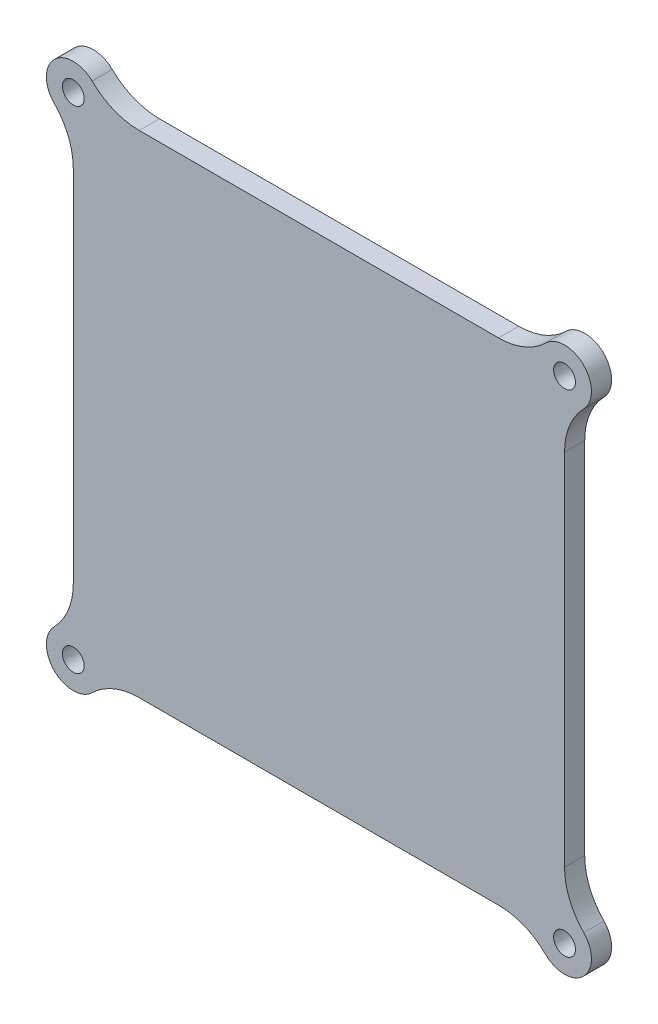
from build123d import *

# Parameters (mm, degrees)
SKETCH_1_R      = 1.625
EXTRUDE_1_DEPTH = 3
FILLET_1_R      = 10


with BuildPart() as part:
    # Эскиз1 → Бобышка-Вытянуть1 (new body)
    with BuildSketch(Plane.XY):
        with BuildLine():
            ThreePointArc((-36.516055554, -32.516055554), (-39.344482678, -39.344482678), (-32.516055554, -36.516055554))
            Line((-32.516055554, -36.516055554), (32.516055554, -36.516055554))
            ThreePointArc((32.516055554, -36.516055554), (39.344482678, -39.344482678), (36.516055554, -32.516055554))
            Line((36.516055554, -32.516055554), (36.516055554, 32.516055554))
            ThreePointArc((36.516055554, 32.516055554), (39.344482678, 39.344482678), (32.516055554, 36.516055554))
            Line((32.516055554, 36.516055554), (-32.516055554, 36.516055554))
            ThreePointArc((-32.516055554, 36.516055554), (-39.344482678, 39.344482678), (-36.516055554, 32.516055554))
            Line((-36.516055554, 32.516055554), (-36.516055554, -32.516055554))
        make_face()
        with Locations((-36.516055554, -36.516055554)):
            Circle(SKETCH_1_R, mode=Mode.SUBTRACT)
        with Locations((36.516055554, 36.516055554)):
            Circle(SKETCH_1_R, mode=Mode.SUBTRACT)
        with Locations((-36.516055554, 36.516055554)):
            Circle(SKETCH_1_R, mode=Mode.SUBTRACT)
        with Locations((36.516055554, -36.516055554)):
            Circle(SKETCH_1_R, mode=Mode.SUBTRACT)
    extrude(amount=EXTRUDE_1_DEPTH)

    # Скругление1
    fillet_1_edges = [part.edges().sort_by_distance(p)[0] for p in [
        (-36.516055554, -32.516055554, 1.5),
        (-36.516055554, 32.516055554, 1.5),
        (-32.516055554, 36.516055554, 1.5),
        (32.516055554, 36.516055554, 1.5),
        (36.516055554, 32.516055554, 1.5),
        (36.516055554, -32.516055554, 1.5),
        (32.516055554, -36.516055554, 1.5),
        (-32.516055554, -36.516055554, 1.5),
    ]]
    fillet(fillet_1_edges, radius=FILLET_1_R)


solid = part.part
